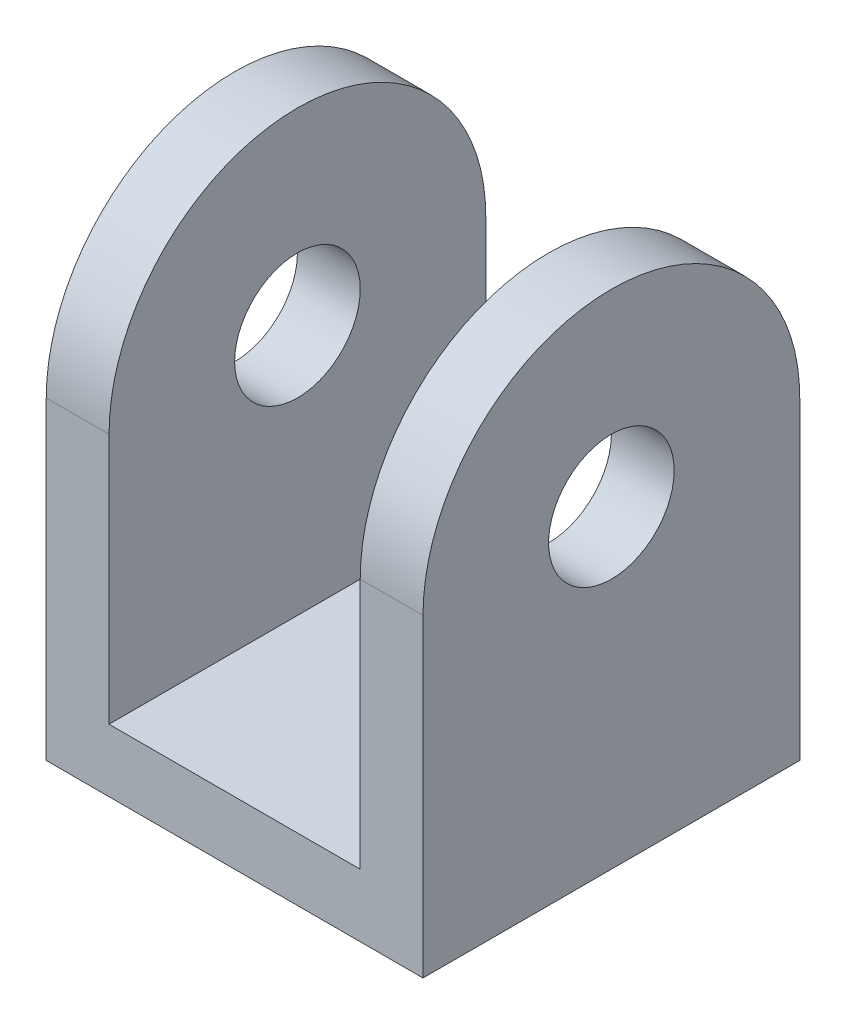
from build123d import *

# Parameters (mm, degrees)
EXTRUDE_1_DEPTH     = 60
SKETCH_3_R          = 10
CUT_EXTRUDE_1_DEPTH = 99.488578018
EXTRUDE_START       = 60
SKETCH_8_R          = 30
SKETCH_8_R_2        = 10
EXTRUDE_5_DEPTH     = 60
SKETCH_10_W         = 40
SKETCH_10_H         = 70
CUT_EXTRUDE_3_DEPTH = 60


with BuildPart() as part:
    # 草圖2 → 填料-伸長1 (new body)
    with BuildSketch(Plane.XY):
        Polygon((0, 0), (60, 0), (60, 50), (50, 50), (50, 10), (10, 10), (10, 50), (0, 50), align=None)
    extrude(amount=EXTRUDE_1_DEPTH)

    # 草圖3 → 除料-伸長1 (cut, through all)
    with BuildSketch(Plane(origin=(60, 0, 0), x_dir=(0, 0, -1), z_dir=(1, 0, 0))):
        with Locations((-30, 50)):
            Circle(SKETCH_3_R)
    extrude(amount=-CUT_EXTRUDE_1_DEPTH, mode=Mode.SUBTRACT)

    # 草圖8 → 填料-伸長5 (add)
    with BuildSketch(Plane(origin=(0, 0, 0), x_dir=(0, 0, -1), z_dir=(1, 0, 0)).offset(EXTRUDE_START)):
        with Locations(Location((-30, 50, 0), (0, 0, 180))):
            Circle(SKETCH_8_R)
        with Locations((-30, 50)):
            Circle(SKETCH_8_R_2, mode=Mode.SUBTRACT)
    extrude(amount=-EXTRUDE_5_DEPTH)

    # 草圖10 → 除料-伸長3 (cut)
    with BuildSketch(Plane.XY.offset(60)):
        with Locations((30, 45)):
            Rectangle(SKETCH_10_W, SKETCH_10_H)
    extrude(amount=-CUT_EXTRUDE_3_DEPTH, mode=Mode.SUBTRACT)


solid = part.part
